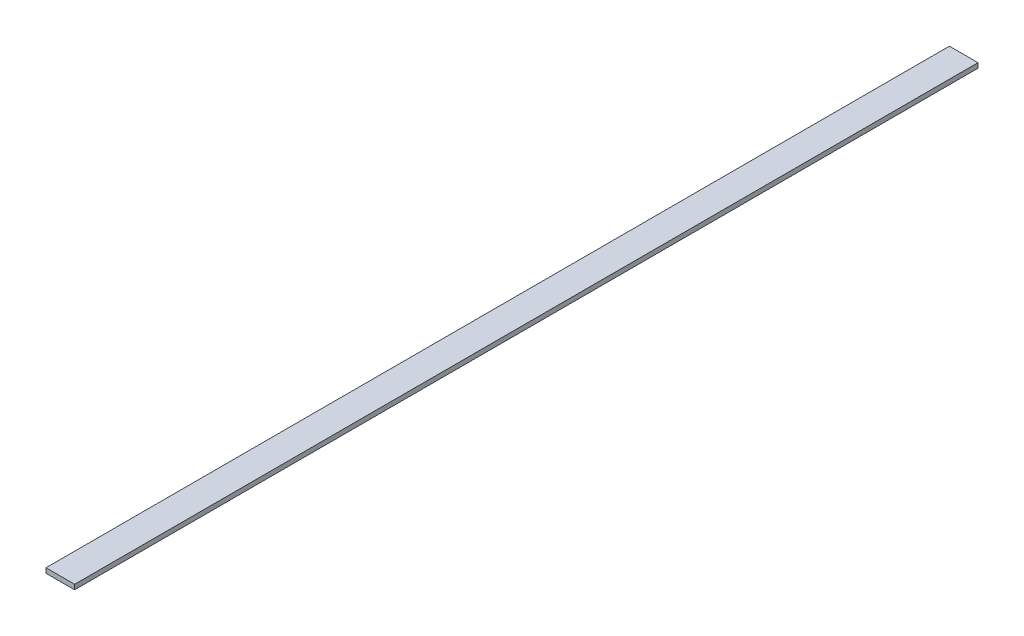
from build123d import *

# Parameters (mm, degrees)
SKETCH_1_W      = 19
SKETCH_1_H      = 3.2
EXTRUDE_1_DEPTH = 600


with BuildPart() as part:
    # 스케치1 → 보스-돌출1 (new body)
    with BuildSketch(Plane.XY):
        with Locations((9.5, 1.6)):
            Rectangle(SKETCH_1_W, SKETCH_1_H)
    extrude(amount=EXTRUDE_1_DEPTH)


solid = part.part
